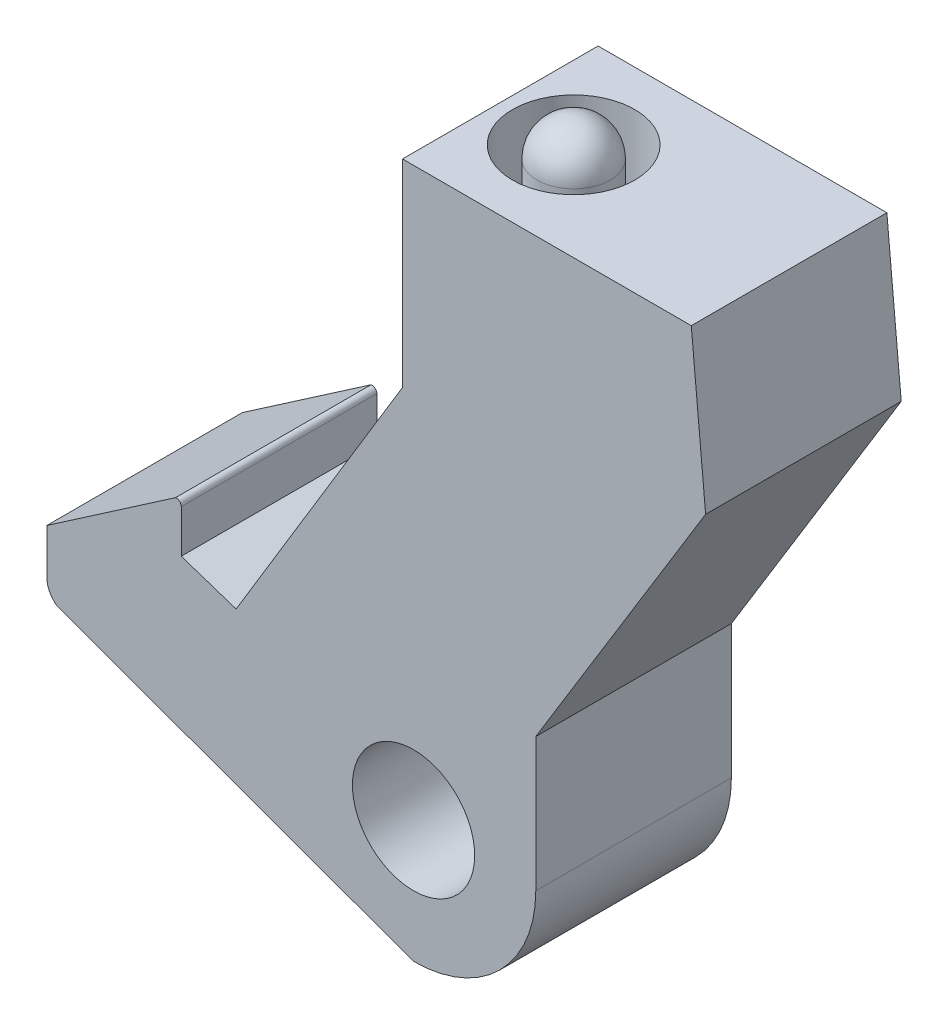
from build123d import *

# Parameters (mm, degrees)
SKETCH_1_R          = 2.5
EXTRUDE_1_DEPTH     = 8
SKETCH_5_R          = 3
CUT_EXTRUDE_2_DEPTH = 3
SKETCH_7_R          = 2
EXTRUDE_3_DEPTH     = 3
FILLET_5_R          = 2
SKETCH_8_R          = 2.5
CUT_EXTRUDE_3_DEPTH = 3
SKETCH_9_R          = 1.5
EXTRUDE_4_DEPTH     = 4
FILLET_6_R          = 1.5


with BuildPart() as part:
    # 스케치1 → 보스-돌출1 (new body)
    with BuildSketch(Plane.XY):
        with BuildLine():
            Line((-0.451148657, 21.875531488), (-0.451148657, 23.195899803))
            Line((-0.451148657, 23.195899803), (11.359015021, 23.195899803))
            Line((11.359015021, 23.195899803), (11.945796901, 16.807444187))
            Line((11.945796901, 16.807444187), (10.112329073, 13.81338505))
            Line((10.112329073, 13.81338505), (5, 5.464934457))
            Line((5, 5.464934457), (5, 3.83484861))
            Line((5, 3.83484861), (5, 0))
            ThreePointArc((5, 0), (3.535533906, -3.535533906), (0, -5))
            Line((0, -5), (-14.582903299, 0.299385373))
            ThreePointArc((-14.582903299, 0.299385373), (-14.889635684, 0.655255963), (-15, 1.111926907))
            Line((-15, 1.111926907), (-15, 2.937976957))
            Line((-15, 2.937976957), (-9.735777088, 6.555734799))
            ThreePointArc((-9.735777088, 6.555734799), (-9.571850512, 6.512511163), (-9.5, 6.358960817))
            Line((-9.5, 6.358960817), (-9.5, 4.598603361))
            Line((-9.5, 4.598603361), (-7.258120431, 3.851310171))
            Line((-7.258120431, 3.851310171), (-0.451148657, 15.101495802))
            Line((-0.451148657, 15.101495802), (-0.451148657, 21.875531488))
        make_face()
        Circle(SKETCH_1_R, mode=Mode.SUBTRACT)
    extrude(amount=EXTRUDE_1_DEPTH)

    # 스케치5 → 컷-돌출2 (cut)
    with BuildSketch(Plane(origin=(-1.605029546, -4.416736851, 0), x_dir=(0.9398656128397294, -0.34154447704713375, 0), z_dir=(-0.34154447704713375, -0.9398656128397295, 0))):
        with Locations((-9.929236479, 4)):
            Circle(SKETCH_5_R)
    extrude(amount=-CUT_EXTRUDE_2_DEPTH, mode=Mode.SUBTRACT)

    # 스케치7 → 보스-돌출3 (add)
    with BuildSketch(Plane(origin=(-0.580396115, -1.597140012, 0), x_dir=(0.9398656128397294, -0.34154447704713387, 0), z_dir=(-0.34154447704713387, -0.9398656128397294, 0))):
        with Locations((-9.929236479, 4)):
            Circle(SKETCH_7_R)
    extrude(amount=EXTRUDE_3_DEPTH)

    # 필렛5
    fillet_5_edges = [part.edges().sort_by_distance(p)[0] for p in [
        (-12.8169087, -0.342372016, 4),
    ]]
    fillet(fillet_5_edges, radius=FILLET_5_R)

    # 스케치8 → 컷-돌출3 (cut)
    with BuildSketch(Plane(origin=(0, 23.195899803, 0), x_dir=(1, 0, 0), z_dir=(0, 1, 0))):
        with Locations(Location((2.548851343, -4, 0), (0, 0, 270))):
            Circle(SKETCH_8_R)
    extrude(amount=-CUT_EXTRUDE_3_DEPTH, mode=Mode.SUBTRACT)

    # 스케치9 → 보스-돌출4 (add)
    with BuildSketch(Plane(origin=(0, 20.195899803, 0), x_dir=(1, 0, 0), z_dir=(0, 1, 0))):
        with Locations(Location((2.548851343, -4, 0), (0, 0, 270))):
            Circle(SKETCH_9_R)
    extrude(amount=EXTRUDE_4_DEPTH)

    # 필렛6
    fillet_6_edges = [part.edges().sort_by_distance(p)[0] for p in [
        (2.548851343, 24.195899803, 2.5),
    ]]
    fillet(fillet_6_edges, radius=FILLET_6_R)


solid = part.part
